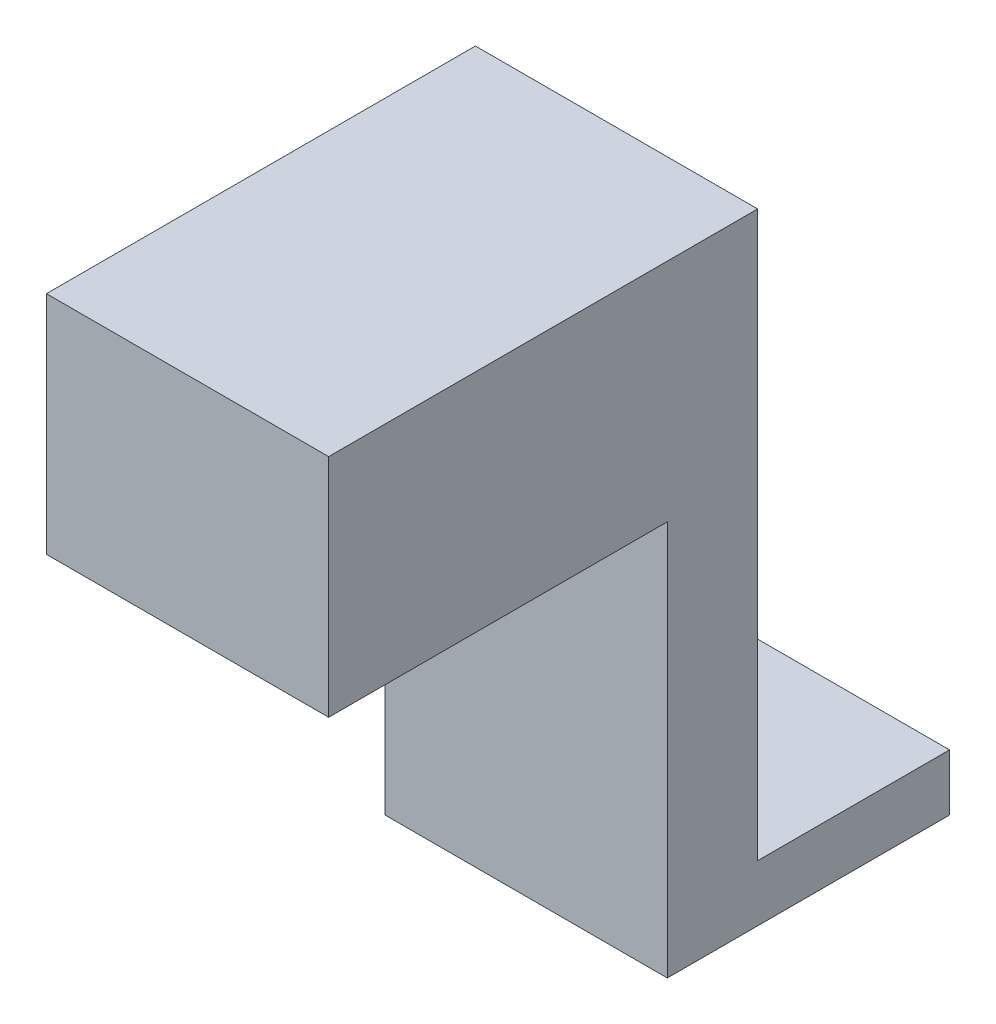
from build123d import *

# Parameters (mm, degrees)
SKETCH1_W           = 25
SKETCH1_H           = 25
BOSS_EXTRUDE1_DEPTH = 5
SKETCH2_W           = 25
SKETCH2_H           = 8
BOSS_EXTRUDE2_DEPTH = 50
SKETCH3_W           = 25
SKETCH3_H           = 20
BOSS_EXTRUDE3_DEPTH = 30


with BuildPart() as part:
    # Sketch1 → Boss-Extrude1 (new body)
    with BuildSketch(Plane(origin=(0, 0, 0), x_dir=(1, 0, 0), z_dir=(0, 1, 0))):
        Rectangle(SKETCH1_W, SKETCH1_H)
    extrude(amount=BOSS_EXTRUDE1_DEPTH)

    # Sketch2 → Boss-Extrude2 (add)
    with BuildSketch(Plane(origin=(0, 5, 0), x_dir=(1, 0, 0), z_dir=(0, 1, 0))):
        with Locations((0, -8.5)):
            Rectangle(SKETCH2_W, SKETCH2_H)
    extrude(amount=BOSS_EXTRUDE2_DEPTH)

    # Sketch3 → Boss-Extrude3 (add)
    with BuildSketch(Plane.XY.offset(12.5)):
        with Locations((0, 45)):
            Rectangle(SKETCH3_W, SKETCH3_H)
    extrude(amount=BOSS_EXTRUDE3_DEPTH)


solid = part.part
